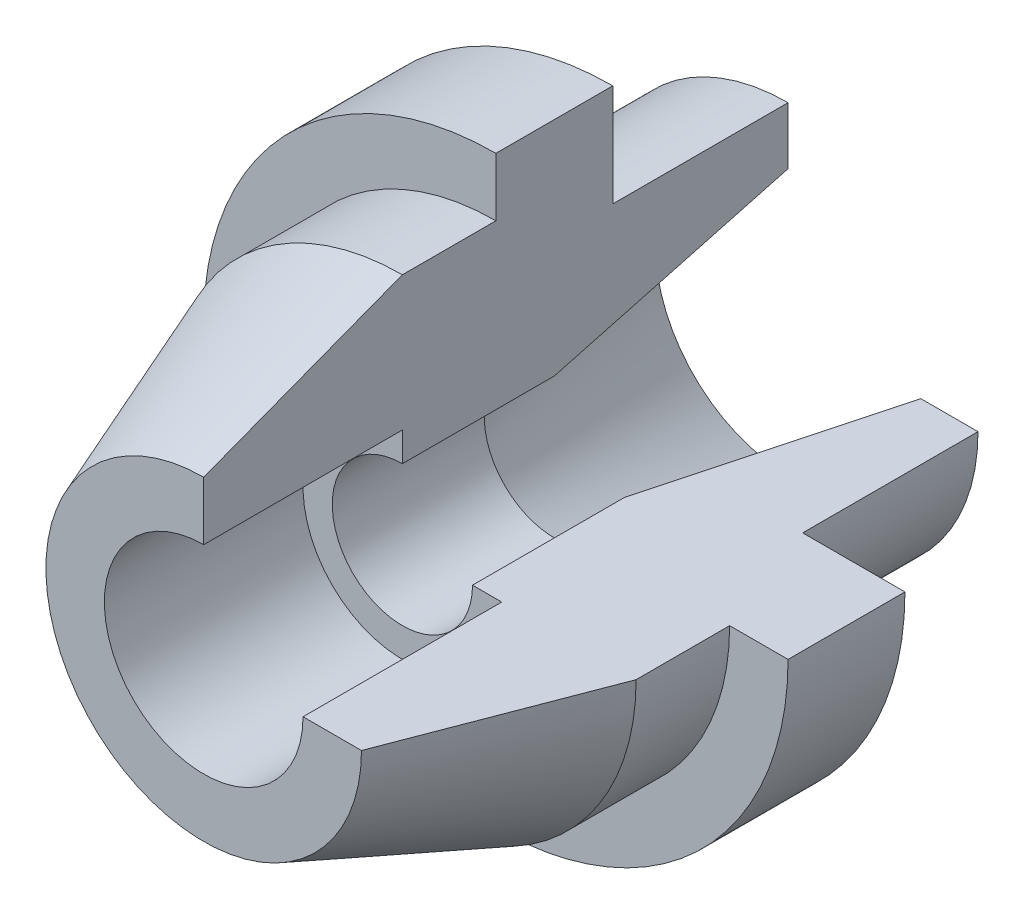
from build123d import *

# Parameters (mm, degrees)
REVOLVE1_ANGLE = 270


with BuildPart() as part:
    # Sketch1 → Revolve1 (revolve)
    with BuildSketch(Plane(origin=(0, 0, 0), x_dir=(0, 0, -1), z_dir=(1, 0, 0))):
        Polygon((0, 0), (0, 27), (34, 40), (50, 40), (50, 50), (70, 50), (70, 32.5), (100, 32.5), (100, 0), align=None)
    revolve(axis=Axis((0, 0, -100), (0, 0, 1)), revolution_arc=REVOLVE1_ANGLE)

    # Sketch2 → Cut-Revolve1 (revolve, cut)
    with BuildSketch(Plane(origin=(0, 0, 0), x_dir=(0, 0, -1), z_dir=(1, 0, 0))):
        Polygon((0, 17), (0, 0), (100, 0), (100, 22.717967697), (60, 12), (34, 12), (34, 17), align=None)
    revolve(axis=Axis((0, 0, 0), (0, 0, -1)), mode=Mode.SUBTRACT)


solid = part.part
